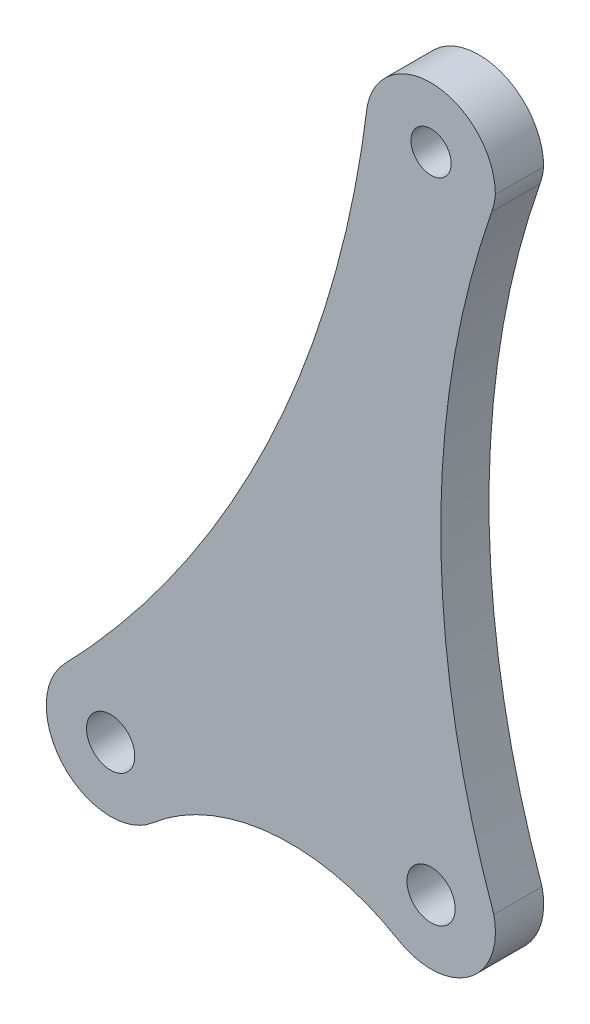
from build123d import *

# Parameters (mm, degrees)
SKETCH_2_R      = 1.25
SKETCH_2_R_2    = 1.5
EXTRUDE_1_DEPTH = 3


with BuildPart() as part:
    # 草圖2 → 填料-伸長1 (new body)
    with BuildSketch(Plane.XY):
        with BuildLine():
            ThreePointArc((31.771756119, 138.671302862), (28.601861286, 119.774671061), (31.9, 100.9))
            ThreePointArc((31.9, 100.9), (30.360629041, 96.771462466), (25.959440964, 96.561632457))
            ThreePointArc((25.959440964, 96.561632457), (18.105782324, 98.350587579), (10.682096943, 95.22501406))
            ThreePointArc((10.682096943, 95.22501406), (5.16557517, 95.514842117), (5.199291514, 101.038869269))
            ThreePointArc((5.199291514, 101.038869269), (17.826888938, 119.231579997), (24.029658233, 140.490850759))
            ThreePointArc((24.029658233, 140.490850759), (28.365250917, 143.714078762), (32.00050872, 139.717647432))
            ThreePointArc((32.00050872, 139.717647432), (31.917708673, 139.187571923), (31.771756119, 138.671302862))
        make_face()
        with Locations((27.99967116, 140.002243515)):
            Circle(SKETCH_2_R, mode=Mode.SUBTRACT)
        with Locations((8.075611168, 98.259296802)):
            Circle(SKETCH_2_R_2, mode=Mode.SUBTRACT)
        with Locations((27.999548416, 100.002200002)):
            Circle(SKETCH_2_R_2, mode=Mode.SUBTRACT)
    extrude(amount=EXTRUDE_1_DEPTH)


solid = part.part
